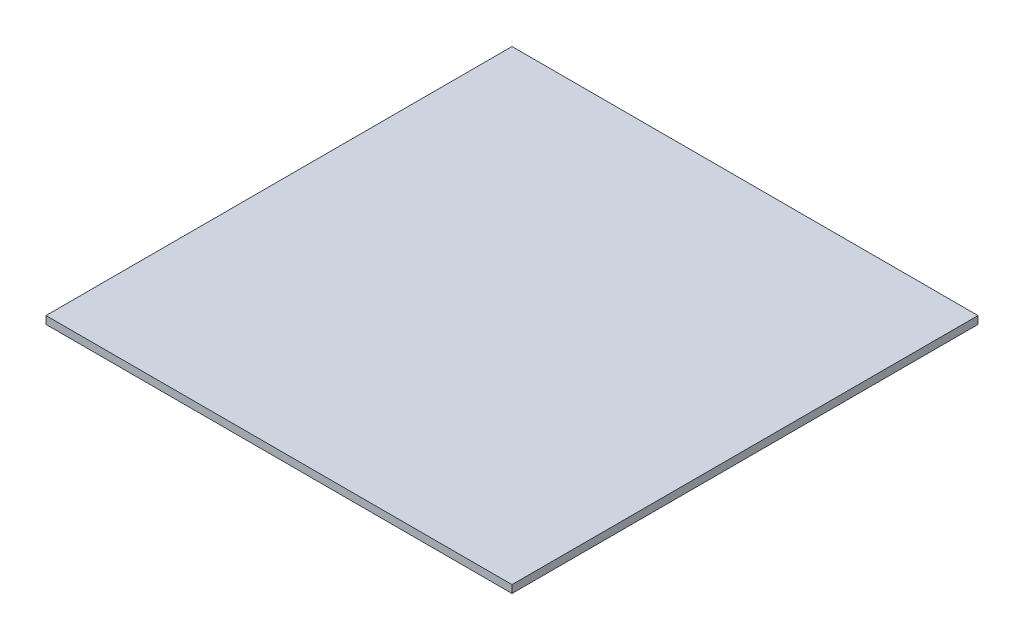
from build123d import *

# Parameters (mm, degrees)
SKETCH1_W           = 191.77
SKETCH1_H           = 191.77
BOSS_EXTRUDE1_DEPTH = 3.175


with BuildPart() as part:
    # Sketch1 → Boss-Extrude1 (new body)
    with BuildSketch(Plane(origin=(0, 0, 0), x_dir=(1, 0, 0), z_dir=(0, 1, 0))):
        with Locations((92.992886905, -94.319151786)):
            Rectangle(SKETCH1_W, SKETCH1_H)
    extrude(amount=BOSS_EXTRUDE1_DEPTH)


solid = part.part
